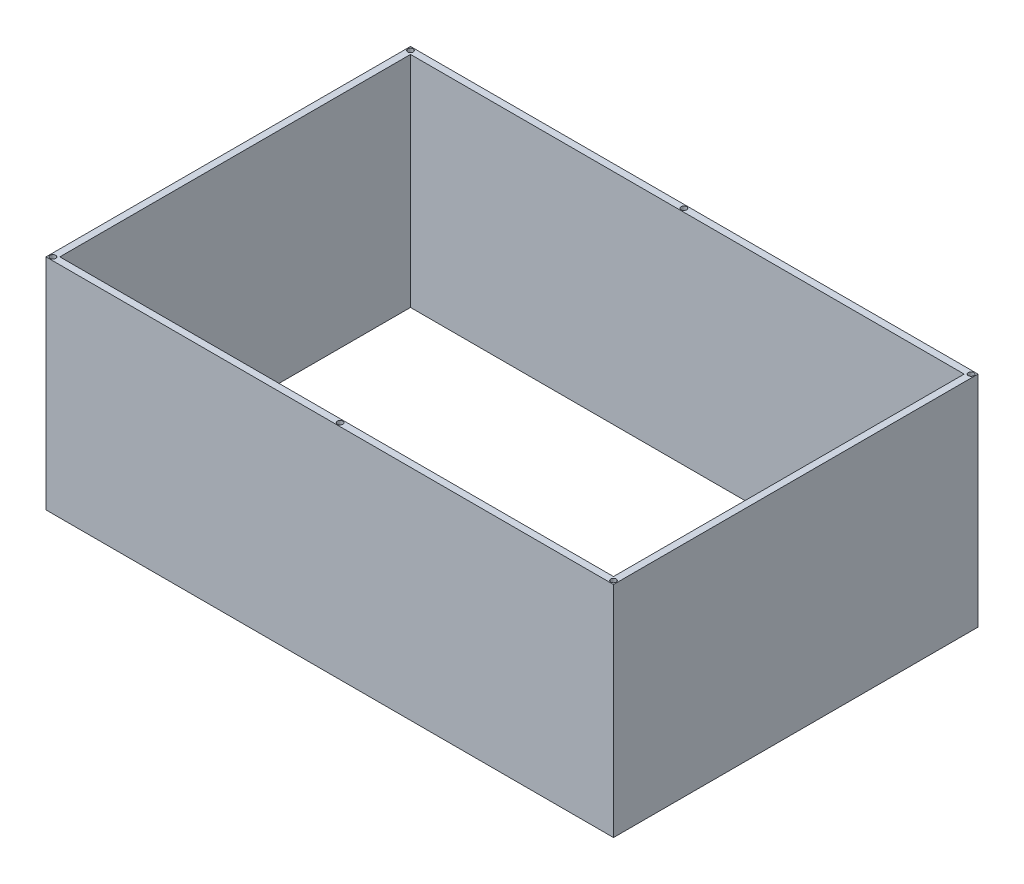
from build123d import *

# Parameters (mm, degrees)
SKETCH5_W                = 246
SKETCH5_H                = 158
SKETCH5_W_2              = 240
SKETCH5_H_2              = 152
BOSS_EXTRUDE1_DEPTH      = 95
M2_CLEARANCE_HOLE1_D     = 2.4
M2_CLEARANCE_HOLE1_DEPTH = 3
M2_CLEARANCE_HOLE1_TIP   = 0.721032743


with BuildPart() as part:
    # Sketch5 → Boss-Extrude1 (new body)
    with BuildSketch(Plane(origin=(0, 0, 0), x_dir=(1, 0, 0), z_dir=(0, 1, 0))):
        Rectangle(SKETCH5_W, SKETCH5_H)
        Rectangle(SKETCH5_W_2, SKETCH5_H_2, mode=Mode.SUBTRACT)
    extrude(amount=BOSS_EXTRUDE1_DEPTH)

    # M2 Clearance Hole1
    with Locations(Plane(origin=(-121.5, 95, -77.5), x_dir=(0, 0, 1), z_dir=(0, 1, 0))):
        with Locations((0, 0), (155, 0), (155, 243), (0, 243), (0, 118.5), (155, 124.5)):
            Hole(M2_CLEARANCE_HOLE1_D / 2, depth=M2_CLEARANCE_HOLE1_DEPTH)
            with Locations((0, 0, -(M2_CLEARANCE_HOLE1_DEPTH + M2_CLEARANCE_HOLE1_TIP / 2))):  # 118° drill point
                Cone(0, M2_CLEARANCE_HOLE1_D / 2, M2_CLEARANCE_HOLE1_TIP, mode=Mode.SUBTRACT)


solid = part.part
